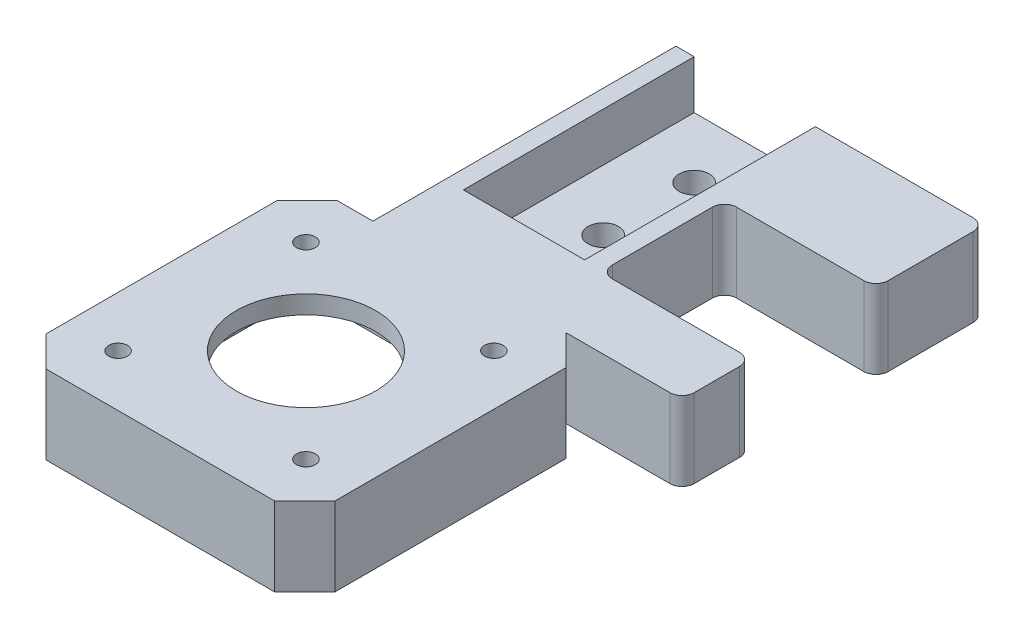
from build123d import *

# Parameters (mm, degrees)
SKETCH_1_W          = 47.691438342
SKETCH_1_H          = 48.077140414
EXTRUDE_2_DEPTH     = 10
SKETCH_4_W          = 47.691438342
SKETCH_4_H          = 48.077140414
EXTRUDE_3_DEPTH     = 3
CUT_EXTRUDE_1_DEPTH = 3
SKETCH_6_R          = 11.5
CUT_EXTRUDE_2_DEPTH = 3
CHAMFER_1_SIZE      = 5
SKETCH_7_W          = 26
SKETCH_7_H          = 13
EXTRUDE_4_DEPTH     = 50
SKETCH_8_W          = 20
SKETCH_8_H          = 40
CUT_EXTRUDE_3_DEPTH = 8
SKETCH_9_W          = 20
SKETCH_9_H          = 8
EXTRUDE_5_DEPTH     = 1.93
SKETCH_10_W         = 11.5
SKETCH_10_H         = 13
SKETCH_10_W_2       = 18
EXTRUDE_6_DEPTH     = 25
FILLET_1_R          = 2
SKETCH_11_R         = 2.5
CUT_EXTRUDE_4_DEPTH = 25


with BuildPart() as part:
    # 草图1 → 凸台-拉伸2 (new body)
    with BuildSketch(Plane(origin=(0, 0, 0), x_dir=(1, 0, 0), z_dir=(0, 1, 0))):
        Rectangle(SKETCH_1_W, SKETCH_1_H)
        Polygon((-21.154280829, -15.961429793), (-16.154280829, -20.961429793), (15.845719171, -20.961429793), (20.845719171, -15.961429793), (20.845719171, 16.038570207), (15.845719171, 21.038570207), (-16.154280829, 21.038570207), (-21.154280829, 16.038570207), align=None, mode=Mode.SUBTRACT)
    extrude(amount=EXTRUDE_2_DEPTH)

    # 草图4 → 凸台-拉伸3 (add)
    with BuildSketch(Plane(origin=(0, 10, 0), x_dir=(1, 0, 0), z_dir=(0, 1, 0))):
        Rectangle(SKETCH_4_W, SKETCH_4_H)
    extrude(amount=EXTRUDE_3_DEPTH)

    # 草图5 → 切除-拉伸1 (cut)
    with BuildSketch(Plane.XZ.offset(-10)):
        with BuildLine():
            ThreePointArc((-13.95, -15.5), (-14.403984489, -14.403984489), (-15.5, -13.95))
            Line((-15.5, -13.95), (-15.5, -15.5))
            Line((-15.5, -15.5), (-13.95, -15.5))
        make_face()
        with BuildLine():
            Line((-15.5, -15.5), (-15.5, -13.95))
            ThreePointArc((-15.5, -13.95), (-16.596015511, -16.596015511), (-13.95, -15.5))
            Line((-13.95, -15.5), (-15.5, -15.5))
        make_face()
        with BuildLine():
            ThreePointArc((17.05, -15.5), (16.596015511, -14.403984489), (15.5, -13.95))
            Line((15.5, -13.95), (15.5, -15.5))
            Line((15.5, -15.5), (13.95, -15.5))
            ThreePointArc((13.95, -15.5), (15.5, -17.05), (17.05, -15.5))
        make_face()
        with BuildLine():
            Line((15.5, -15.5), (15.5, -13.95))
            ThreePointArc((15.5, -13.95), (14.403984489, -14.403984489), (13.95, -15.5))
            Line((13.95, -15.5), (15.5, -15.5))
        make_face()
        with BuildLine():
            ThreePointArc((17.05, 15.5), (15.5, 17.05), (13.95, 15.5))
            Line((13.95, 15.5), (15.5, 15.5))
            Line((15.5, 15.5), (15.5, 13.95))
            ThreePointArc((15.5, 13.95), (16.596015511, 14.403984489), (17.05, 15.5))
        make_face()
        with BuildLine():
            Line((15.5, 15.5), (13.95, 15.5))
            ThreePointArc((13.95, 15.5), (14.403984489, 14.403984489), (15.5, 13.95))
            Line((15.5, 13.95), (15.5, 15.5))
        make_face()
        with BuildLine():
            ThreePointArc((-15.5, 13.95), (-14.403984489, 14.403984489), (-13.95, 15.5))
            Line((-13.95, 15.5), (-15.5, 15.5))
            Line((-15.5, 15.5), (-15.5, 13.95))
        make_face()
        with BuildLine():
            Line((-15.5, 15.5), (-13.95, 15.5))
            ThreePointArc((-13.95, 15.5), (-16.596015511, 16.596015511), (-15.5, 13.95))
            Line((-15.5, 13.95), (-15.5, 15.5))
        make_face()
    extrude(amount=-CUT_EXTRUDE_1_DEPTH, mode=Mode.SUBTRACT)

    # 草图6 → 切除-拉伸2 (cut)
    with BuildSketch(Plane(origin=(0, 13, 0), x_dir=(1, 0, 0), z_dir=(0, 1, 0))):
        with Locations(Location((0, 0, 0), (0, 0, 270))):
            Circle(SKETCH_6_R)
    extrude(amount=-CUT_EXTRUDE_2_DEPTH, mode=Mode.SUBTRACT)

    # 倒角1
    chamfer_1_edges = [part.edges().sort_by_distance(p)[0] for p in [
        (23.845719171, 6.5, -24.038570207),
        (23.845719171, 6.5, 24.038570207),
        (-23.845719171, 6.5, 24.038570207),
        (-23.845719171, 6.5, -24.038570207),
    ]]
    chamfer(chamfer_1_edges, length=CHAMFER_1_SIZE)

    # 草图7 → 凸台-拉伸4 (add)
    with BuildSketch(Plane(origin=(0, 0, -24.038570207), x_dir=(-1, 0, 0), z_dir=(0, 0, -1))):
        with Locations((0, 6.5)):
            Rectangle(SKETCH_7_W, SKETCH_7_H)
    extrude(amount=EXTRUDE_4_DEPTH)

    # 草图8 → 切除-拉伸3 (cut)
    with BuildSketch(Plane(origin=(0, 13, 0), x_dir=(1, 0, 0), z_dir=(0, 1, 0))):
        with Locations((0, 54.038570207)):
            Rectangle(SKETCH_8_W, SKETCH_8_H)
    extrude(amount=-CUT_EXTRUDE_3_DEPTH, mode=Mode.SUBTRACT)

    # 草图9 → 凸台-拉伸5 (add)
    with BuildSketch(Plane(origin=(0, 0, -34.038570207), x_dir=(-1, 0, 0), z_dir=(0, 0, -1))):
        with Locations((0, 9)):
            Rectangle(SKETCH_9_W, SKETCH_9_H)
    extrude(amount=EXTRUDE_5_DEPTH)

    # 草图10 → 凸台-拉伸6 (add)
    with BuildSketch(Plane(origin=(13, 0, 0), x_dir=(0, 0, -1), z_dir=(1, 0, 0))):
        with Locations((29.788570207, 6.5)):
            Rectangle(SKETCH_10_W, SKETCH_10_H)
        with Locations((65.038570207, 6.5)):
            Rectangle(SKETCH_10_W_2, SKETCH_10_H)
    extrude(amount=EXTRUDE_6_DEPTH)

    # 圆角1
    fillet_1_edges = [part.edges().sort_by_distance(p)[0] for p in [
        (-13, 0, -49.038570207),
        (13, 6.5, -35.538570207),
        (38, 6.5, -24.038570207),
        (38, 6.5, -35.538570207),
        (13, 6.5, -56.038570207),
        (38, 6.5, -56.038570207),
        (38, 6.5, -74.038570207),
    ]]
    fillet(fillet_1_edges, radius=FILLET_1_R)

    # 草图11 → 切除-拉伸4 (cut)
    with BuildSketch(Plane(origin=(0, 5, 0), x_dir=(1, 0, 0), z_dir=(0, 1, 0))):
        with Locations(Location((0, 64.038570207, 0), (0, 0, 270))):
            Circle(SKETCH_11_R)
        with Locations(Location((0, 49.038570207, 0), (0, 0, 270))):
            Circle(SKETCH_11_R)
    extrude(amount=-CUT_EXTRUDE_4_DEPTH, mode=Mode.SUBTRACT)


solid = part.part
